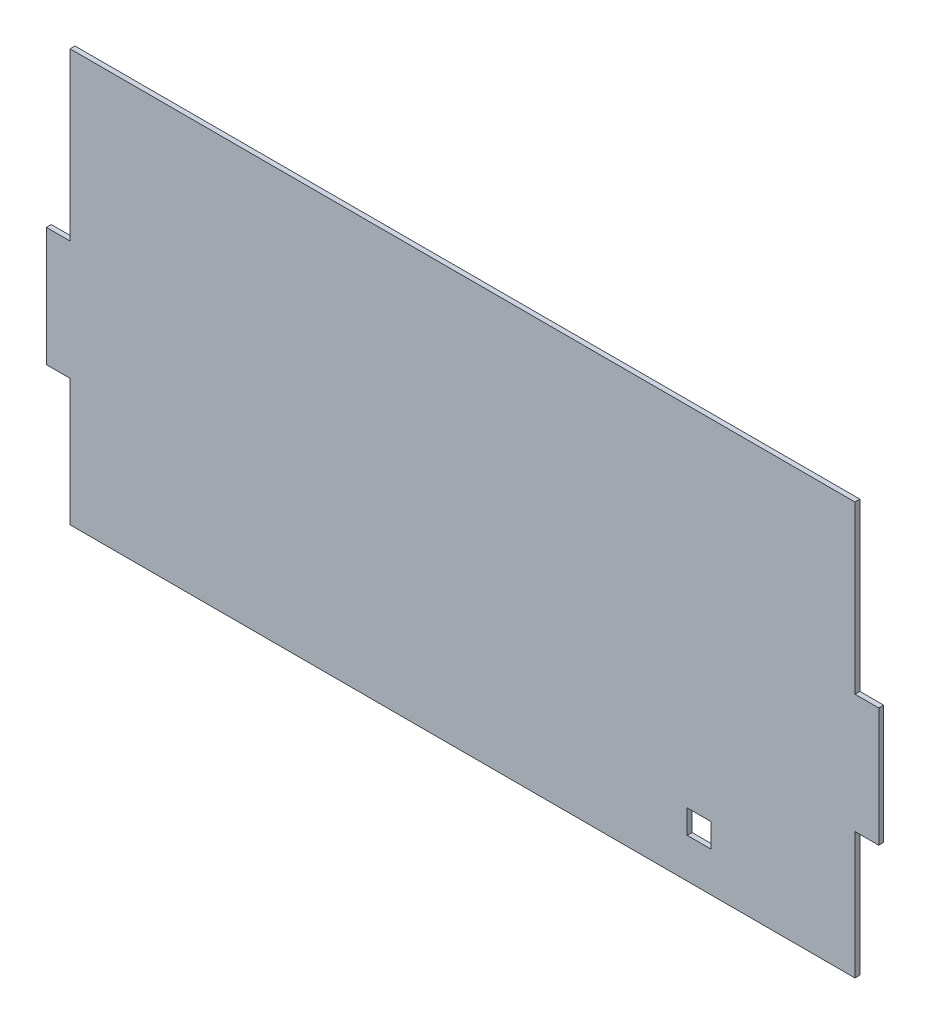
from build123d import *

# Parameters (mm, degrees)
SKETCH1_W           = 14.51987794
SKETCH1_H           = 14.519877941
BOSS_EXTRUDE1_DEPTH = 3


with BuildPart() as part:
    # Sketch1 → Boss-Extrude1 (new body)
    with BuildSketch(Plane.XY):
        Polygon((987.723312498, 1158.835897417), (1002.243190438, 1158.835897417), (1002.243190438, 1231.438621954), (987.723312498, 1231.438621954), (987.723312498, 1333.074432697), (508.564005642, 1333.074432697), (508.564005642, 1231.438621954), (494.044127702, 1231.438621954), (494.044127702, 1158.835897417), (508.564005642, 1158.835897417), (508.564005642, 1081.397660016), (987.723312498, 1081.397660016), align=None)
        with Locations((892.57042383, 1112.86350942)):
            Rectangle(SKETCH1_W, SKETCH1_H, mode=Mode.SUBTRACT)
    extrude(amount=BOSS_EXTRUDE1_DEPTH)


solid = part.part
